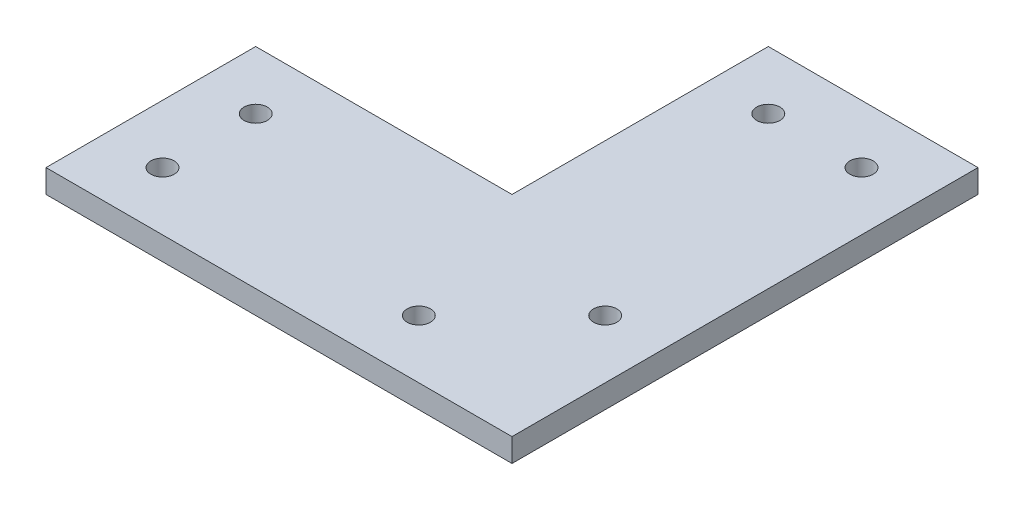
from build123d import *

# Parameters (mm, degrees)
SKETCH1_R           = 1.5875
BOSS_EXTRUDE1_DEPTH = 3.175


with BuildPart() as part:
    # Sketch1 → Boss-Extrude1 (new body)
    with BuildSketch(Plane(origin=(0, 0, 0), x_dir=(1, 0, 0), z_dir=(0, 1, 0))):
        Polygon((0, 0), (0, 28.575), (34.925, 28.575), (34.925, 63.5), (63.5, 63.5), (63.5, 0), align=None)
        with Locations(Location((7.9375, 20.6375, 0), (0, 0, 270))):
            Circle(SKETCH1_R, mode=Mode.SUBTRACT)
        with Locations(Location((7.9375, 7.9375, 0), (0, 0, 270))):
            Circle(SKETCH1_R, mode=Mode.SUBTRACT)
        with Locations(Location((42.8625, 7.9375, 0), (0, 0, 270))):
            Circle(SKETCH1_R, mode=Mode.SUBTRACT)
        with Locations(Location((55.5625, 20.6375, 0), (0, 0, 270))):
            Circle(SKETCH1_R, mode=Mode.SUBTRACT)
        with Locations(Location((55.5625, 55.5625, 0), (0, 0, 270))):
            Circle(SKETCH1_R, mode=Mode.SUBTRACT)
        with Locations(Location((42.8625, 55.5625, 0), (0, 0, 270))):
            Circle(SKETCH1_R, mode=Mode.SUBTRACT)
    extrude(amount=BOSS_EXTRUDE1_DEPTH)


solid = part.part
